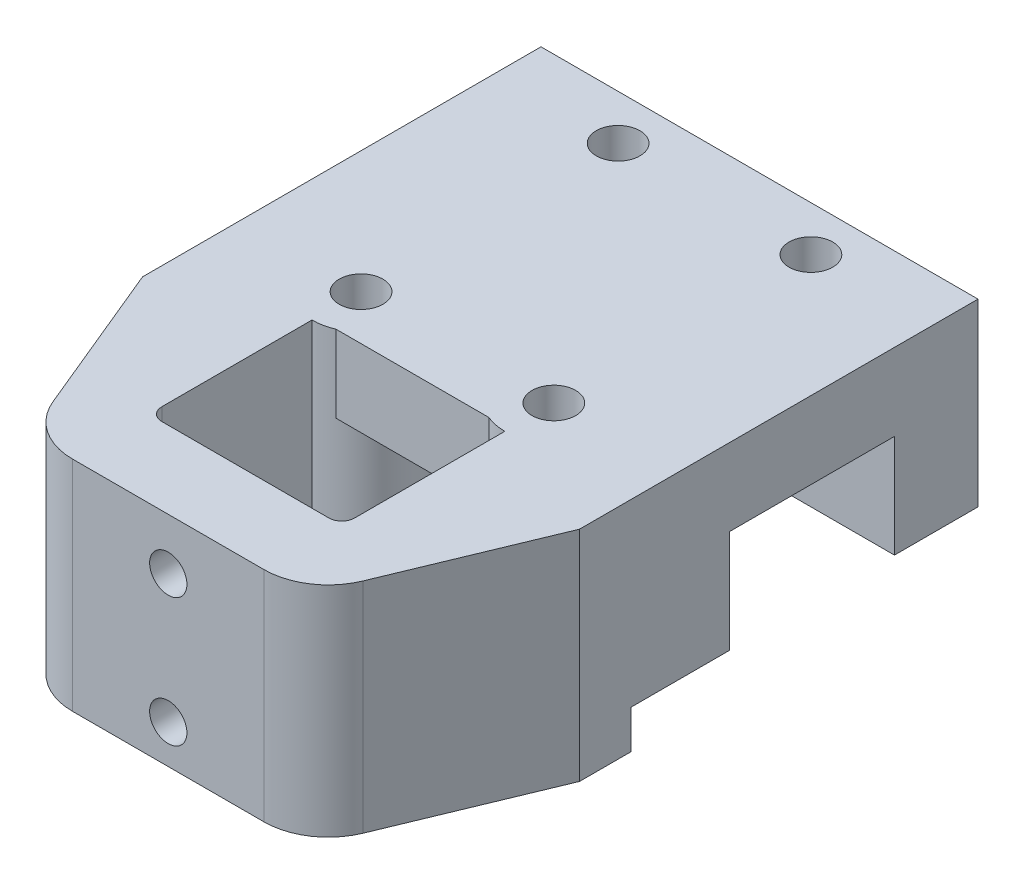
from build123d import *
from OCP.BRepFilletAPI import BRepFilletAPI_MakeChamfer
from build123d.topology import SkipClean

# Parameters (mm, degrees)
SKETCH3_W                  = 34
SKETCH3_H                  = 46
BOSS_EXTRUDE1_DEPTH        = 14
M3_CLEARANCE_HOLE1_D       = 3.4
CUT_EXTRUDE1_DEPTH         = 40.258756985
CUT_EXTRUDE1_DEPTH_BACK    = 40.258756985
SKETCH6_W                  = 12.8166
SKETCH6_H                  = 8
CUT_EXTRUDE2_DEPTH         = 38.539978689
CHAMFER1_SIZE              = 15
CHAMFER1_SIZE2             = 6.213203436
CUT_EXTRUDE3_REACH         = 39.54
BOSS_EXTRUDE2_DEPTH        = 3
FILLET1_R                  = 1
M2_5_CLEARANCE_HOLE1_D     = 2.9
M2_5_CLEARANCE_HOLE1_DEPTH = 6
FILLET2_R                  = 5


with BuildPart() as part:
    # Sketch3 → Boss-Extrude1 (new body)
    with BuildSketch(Plane(origin=(0, 0, 0), x_dir=(1, 0, 0), z_dir=(0, 1, 0))):
        with Locations((0, -9.5)):
            Rectangle(SKETCH3_W, SKETCH3_H)
    extrude(amount=-BOSS_EXTRUDE1_DEPTH)

    # M3 Clearance Hole1 (through all)
    with Locations(Plane(origin=(0, 0, 0), x_dir=(-1, 0, 0), z_dir=(0, 1, 0))):
        with Locations((7.5, 10), (7.5, -10), (-7.5, -10), (-7.5, 10)):
            Hole(M3_CLEARANCE_HOLE1_D / 2)

    # Sketch6 → Cut-Extrude1 (cut, two sides: drawn at the far end of the back side and taken through both)
    with BuildSketch(Plane(origin=(0, 0, 0), x_dir=(0, 0, -1), z_dir=(1, 0, 0)).offset(-CUT_EXTRUDE1_DEPTH_BACK)):
        with Locations((0.5917, -10)):
            Rectangle(SKETCH6_W, SKETCH6_H)
    extrude(amount=CUT_EXTRUDE1_DEPTH + CUT_EXTRUDE1_DEPTH_BACK, mode=Mode.SUBTRACT)

    # Sketch7 → Cut-Extrude2 (cut, through all)
    with BuildSketch(Plane(origin=(0, -6, 0), x_dir=(1, 0, 0), z_dir=(0, 1, 0))):
        with BuildLine():
            Line((-7.5, -26.5), (7.5, -26.5))
            Line((7.5, -26.5), (7.5, -13.8166))
            ThreePointArc((7.5, -13.8166), (3.5, -9.8166), (7.5, -5.8166))
            Line((7.5, -5.8166), (-7.5, -5.8166))
            ThreePointArc((-7.5, -5.8166), (-3.5, -9.8166), (-7.5, -13.8166))
            Line((-7.5, -13.8166), (-7.5, -26.5))
        make_face()
    extrude(amount=-CUT_EXTRUDE2_DEPTH, mode=Mode.SUBTRACT)

    # Chamfer1: one chamfer whose edges measure the first distance from different faces: ONE call of the kernel's chamfer builder (chamfer() names one face for all edges)
    chamfer1_edges_1 = [part.edges().sort_by_distance(p)[0] for p in [
        (17, -7, 32.5),
    ]]
    chamfer1_side_1 = [part.faces().sort_by_distance(p)[0] for p in [
        (17, -6.431916836, 11.410974954),
    ]]
    chamfer1_edges_2 = [part.edges().sort_by_distance(p)[0] for p in [
        (-17, -7, 32.5),
    ]]
    chamfer1_side_2 = [part.faces().sort_by_distance(p)[0] for p in [
        (-17, -6.431916836, 11.410974954),
    ]]
    chamfer1 = BRepFilletAPI_MakeChamfer(part.part.solid().wrapped)
    for e in chamfer1_edges_1:
        chamfer1.Add(CHAMFER1_SIZE, CHAMFER1_SIZE2, e.wrapped, chamfer1_side_1[0].wrapped)  # the first distance lies on this face
    for e in chamfer1_edges_2:
        chamfer1.Add(CHAMFER1_SIZE, CHAMFER1_SIZE2, e.wrapped, chamfer1_side_2[0].wrapped)  # the first distance lies on this face
    add(Compound.cast(chamfer1.Shape()), mode=Mode.REPLACE)

    # Sketch12 → Cut-Extrude3 (cut, up to next)
    with BuildSketch(Plane.XZ.offset(6), mode=Mode.PRIVATE) as cut_extrude3_sk1:
        with BuildLine():
            Line((5.940331946, 13.5), (-5.940331946, 13.5))
            ThreePointArc((-5.940331946, 13.5), (-6.704261349, 13.73665102), (-7.5, 13.8166))
            Line((-7.5, 13.8166), (-7.5, 26.5))
            Line((-7.5, 26.5), (7.5, 26.5))
            Line((7.5, 26.5), (7.5, 13.8166))
            ThreePointArc((7.5, 13.8166), (6.704261349, 13.73665102), (5.940331946, 13.5))
        make_face()
    cut_extrude3_tool1 = extrude(cut_extrude3_sk1.sketch, amount=-CUT_EXTRUDE3_REACH, mode=Mode.PRIVATE) & part.part
    add(cut_extrude3_tool1.solids().sort_by_distance((0, -6, 20.021768))[0], mode=Mode.SUBTRACT)

    # Sketch14 → Boss-Extrude2 (add)
    with SkipClean():  # the faces are left unmerged after this step: merging them gives an invalid solid
        with BuildSketch(Plane.XZ.offset(14)):
            Polygon((-17, 13.5), (-7.5, 13.5), (-7.5, 26.5), (7.5, 26.5), (7.5, 13.5), (17, 13.5), (17, 17.5), (10.786796564, 32.5), (-10.786796564, 32.5), (-17, 17.5), align=None)
        extrude(amount=BOSS_EXTRUDE2_DEPTH)

    # Fillet1
    fillet1_edges = [part.edges().sort_by_distance(p)[0] for p in [
        (-7.5, -10, 26.5),
        (7.5, -10, 26.5),
    ]]
    fillet(fillet1_edges, radius=FILLET1_R)

    # M2.5 Clearance Hole1
    with Locations(Plane.XY.offset(32.5)):
        with Locations((0, -4), (0, -14)):
            Hole(M2_5_CLEARANCE_HOLE1_D / 2, depth=M2_5_CLEARANCE_HOLE1_DEPTH)

    # Fillet2
    fillet2_edges = [part.edges().sort_by_distance(p)[0] for p in [
        (10.786796564, -7, 32.5),
        (-10.786796564, -7, 32.5),
    ]]
    fillet(fillet2_edges, radius=FILLET2_R)


solid = part.part
